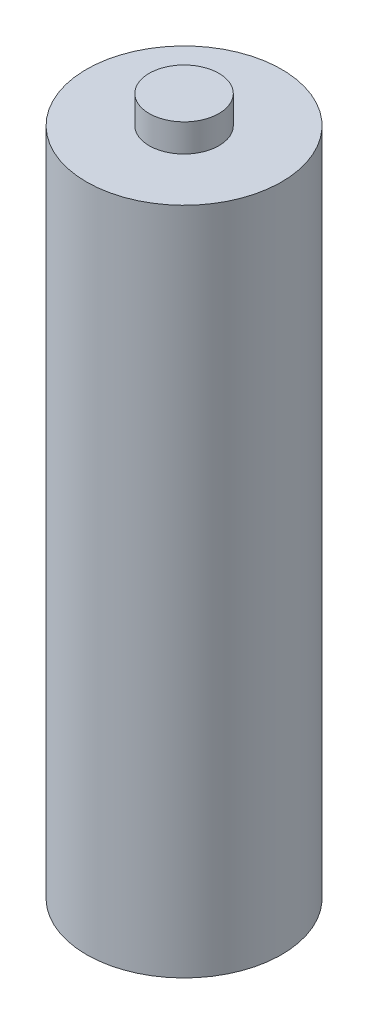
from build123d import *

# Parameters (mm, degrees)
SKETCH_1_R      = 2.5
EXTRUDE_1_DEPTH = 50
SKETCH_1_3_R    = 7
EXTRUDE_2_DEPTH = 48


with BuildPart() as part:
    # 草图1 → 凸台-拉伸1 (new body)
    with BuildSketch(Plane(origin=(0, 0, 0), x_dir=(1, 0, 0), z_dir=(0, 1, 0))):
        Circle(SKETCH_1_R)
    extrude(amount=EXTRUDE_1_DEPTH)

    # 草图1<3> → 凸台-拉伸2 (add)
    with BuildSketch(Plane(origin=(0, 0, 0), x_dir=(1, 0, 0), z_dir=(0, 1, 0))):
        Circle(SKETCH_1_3_R)
    extrude(amount=EXTRUDE_2_DEPTH)


solid = part.part
